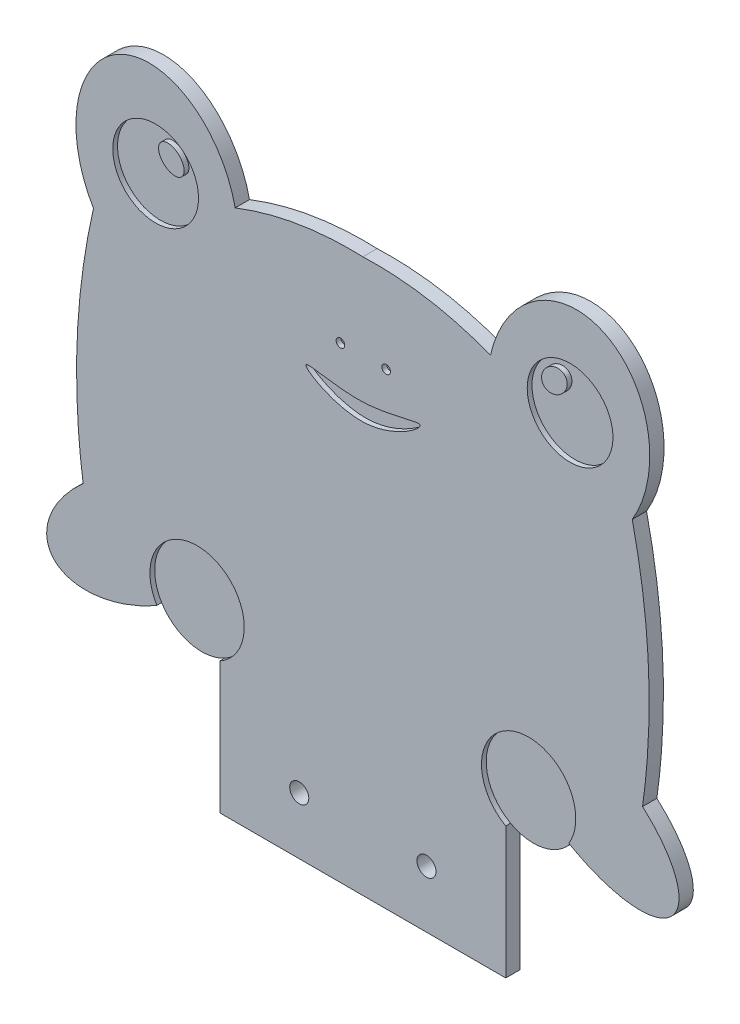
from build123d import *

# Parameters (mm, degrees)
BOSS_EXTRUDE1_DEPTH = 3
SKETCH6_R           = 9
SKETCH6_RX          = 3
SKETCH6_RY          = 2.25
CUT_EXTRUDE1_DEPTH  = 1
SKETCH8_R           = 0.9
CUT_EXTRUDE2_DEPTH  = 1
CUT_EXTRUDE3_START  = -1
SKETCH9_R           = 9.9
CUT_EXTRUDE3_DEPTH  = 1
SKETCH11_R          = 2
CUT_EXTRUDE4_DEPTH  = 97.871700585


with BuildPart() as part:
    # Sketch5 → Boss-Extrude1 (new body)
    with BuildSketch(Plane.XY):
        with BuildLine():
            Line((30, -70.5), (30, -42.858521814))
            ThreePointArc((30, -42.858521814), (37.315282413, -43.775142526), (43.235660947, -39.38166232))
            add(Edge.make_bspline(
                [(43.235660947, -39.38166232), (58.132031931, -48.075183521), (64.619655506, -42.03715417), (71.107279081, -35.99912482), (58.715402701, -24.974671227)],
                knots=[1.631392593, 1.631392593, 1.631392593, 3.007948846, 3.007948846, 4.384505098, 4.384505098, 4.384505098], degree=2, weights=[1, 0.772340908, 1, 0.772340908, 1]))
            add(Edge.make_bspline(
                [(56.549047154, 26.153569201), (62.317157968, 0.672580157), (58.715402701, -24.974671227)],
                knots=[0, 0, 0, 0.80386391, 0.80386391, 0.80386391], degree=2))
            add(Edge.make_bspline(
                [(56.549047154, 26.153569201), (72.478075564, 52.664667739), (47.735913053, 58.11)],
                knots=[4.312696904, 4.312696904, 4.312696904, 6.283185307, 6.283185307, 6.283185307], degree=2, weights=[1, 0.552659612, 1]))
            add(Edge.make_bspline(
                [(47.735913053, 58.11), (31.328572236, 61.720978718), (26.792659183, 41.110978718)],
                knots=[0, 0, 0, 1.570796327, 1.570796327, 1.570796327], degree=2, weights=[1, 0.707106781, 1]))
            add(Edge.make_bspline(
                [(26.792659183, 41.110978718), (13.889471842, 46.131954763), (0, 45.6)],
                knots=[0, 0, 0, 1, 1, 1], degree=2))
            add(Edge.make_bspline(
                [(-26.792659183, 41.110978718), (-13.889471842, 46.131954763), (0, 45.6)],
                knots=[0, 0, 0, 1, 1, 1], degree=2))
            add(Edge.make_bspline(
                [(-26.792659183, 41.110978718), (-31.328572236, 61.720978718), (-47.735913053, 58.11)],
                knots=[4.71238898, 4.71238898, 4.71238898, 6.283185307, 6.283185307, 6.283185307], degree=2, weights=[1, 0.707106781, 1]))
            add(Edge.make_bspline(
                [(-47.735913053, 58.11), (-72.478075564, 52.664667739), (-56.549047154, 26.153569201)],
                knots=[0, 0, 0, 1.970488403, 1.970488403, 1.970488403], degree=2, weights=[1, 0.552659612, 1]))
            add(Edge.make_bspline(
                [(-56.549047154, 26.153569201), (-62.317157968, 0.672580157), (-58.715402701, -24.974671227)],
                knots=[0, 0, 0, 0.80386391, 0.80386391, 0.80386391], degree=2))
            add(Edge.make_bspline(
                [(-58.715402701, -24.974671227), (-71.107279081, -35.99912482), (-64.619655506, -42.03715417), (-58.132031931, -48.075183521), (-43.235660947, -39.38166232)],
                knots=[1.898680209, 1.898680209, 1.898680209, 3.275236462, 3.275236462, 4.651792714, 4.651792714, 4.651792714], degree=2, weights=[1, 0.772340908, 1, 0.772340908, 1]))
            ThreePointArc((-43.235660947, -39.38166232), (-37.315282413, -43.775142526), (-30, -42.858521814))
            Line((-30, -42.858521814), (-30, -70.5))
            Line((-30, -70.5), (30, -70.5))
        make_face()
    extrude(amount=BOSS_EXTRUDE1_DEPTH)

    # Sketch6 → Cut-Extrude1 (cut)
    # profile 1 of 2: a face of its own
    with BuildSketch(Plane.XY.offset(3)):
        with Locations((-43.5, 39)):
            Circle(SKETCH6_R)
        with Locations(Location((-40.2, 43.2), (0, 0, -42.5))):
            Ellipse(SKETCH6_RX, SKETCH6_RY, mode=Mode.SUBTRACT)
    # profile 2 of 2: a face of its own
    with BuildSketch(Plane.XY.offset(3)):
        with Locations(Location((43.5, 39, 0), (0, 0, 180))):
            Circle(SKETCH6_R)
        with Locations(Location((40.2, 43.2), (0, 0, -137.5))):
            Ellipse(SKETCH6_RX, SKETCH6_RY, mode=Mode.SUBTRACT)
    extrude(amount=-CUT_EXTRUDE1_DEPTH, mode=Mode.SUBTRACT)

    # Sketch8 → Cut-Extrude2 (cut)
    with BuildSketch(Plane.XY.offset(3)):
        with Locations((-4.707068729, 27.599723196)):
            Circle(SKETCH8_R)
        with Locations((4.892931271, 27.599723196)):
            Circle(SKETCH8_R)
        with BuildLine():
            add(Edge.make_bspline(
                [(-11.979169159, 20), (-11.750254308, 20.789084004), (0.167482991, 17.134006636), (17.916374199, 24.224744695), (0.336817721, 11.525386795), (-12.221853811, 19.163450614), (-11.979169159, 20)],
                knots=[0, 0, 0, 0, 0.242087492, 0.482200716, 0.743350338, 1, 1, 1, 1], degree=3))
        make_face()
    extrude(amount=-CUT_EXTRUDE2_DEPTH, mode=Mode.SUBTRACT)

    # Sketch9 → Cut-Extrude3 (cut)
    with BuildSketch(Plane.XY.offset(3).offset(CUT_EXTRUDE3_START)):
        with Locations((-34.8, -34.2)):
            Circle(SKETCH9_R)
        with Locations((34.8, -34.2)):
            Circle(SKETCH9_R)
    extrude(amount=CUT_EXTRUDE3_DEPTH, mode=Mode.SUBTRACT)

    # Sketch11 → Cut-Extrude4 (cut, through all)
    with BuildSketch(Plane.XY.offset(3)):
        with Locations((-13.35, -58.5)):
            Circle(SKETCH11_R)
        with Locations((13.35, -58.5)):
            Circle(SKETCH11_R)
    extrude(amount=-CUT_EXTRUDE4_DEPTH, mode=Mode.SUBTRACT)


solid = part.part
